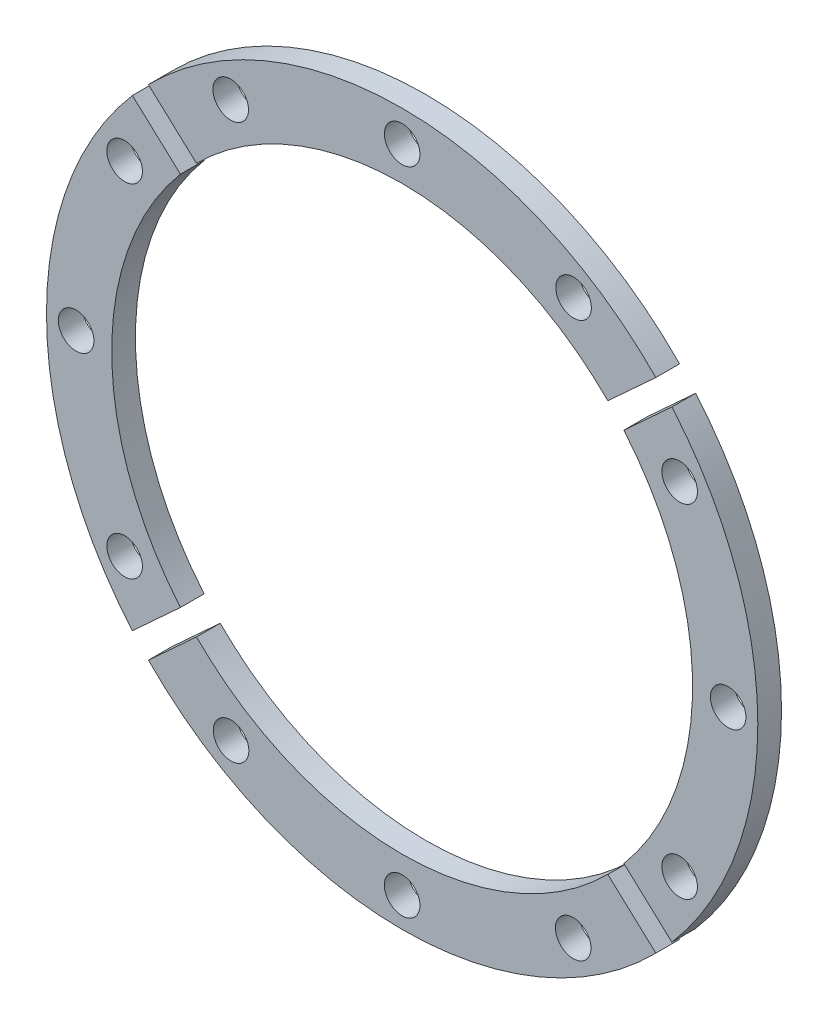
from build123d import *

# Parameters (mm, degrees)
IZIM1_R                       = 15
Y_KSEKLIK_EKSTR_ZYON1_DEPTH   = 20
Y_KSEKLIK_EKSTR_ZYON1_2_DEPTH = 20
Y_KSEKLIK_EKSTR_ZYON1_3_DEPTH = 20
Y_KSEKLIK_EKSTR_ZYON1_4_DEPTH = 20


with BuildPart() as part:
    # Çizim1 → Yükseklik-Ekstrüzyon1 (new body)
    with BuildSketch(Plane.XY):
        with BuildLine():
            Line((-187.021124904, 158.265911805), (-227.547884488, 195.504374031))
            ThreePointArc((-227.547884488, 195.504374031), (-300, 0), (-227.547884488, -195.504374031))
            Line((-227.547884488, -195.504374031), (-187.021124904, -158.265911805))
            ThreePointArc((-187.021124904, -158.265911805), (-245, 0), (-187.021124904, 158.265911805))
        make_face()
        with Locations((-234.090909091, -144.313707876)):
            Circle(IZIM1_R, mode=Mode.SUBTRACT)
        with Locations((-275, 0)):
            Circle(IZIM1_R, mode=Mode.SUBTRACT)
        with Locations((-234.090909091, 144.313707876)):
            Circle(IZIM1_R, mode=Mode.SUBTRACT)
    extrude(amount=Y_KSEKLIK_EKSTR_ZYON1_DEPTH)


with BuildPart() as body_2:
    # Çizim1 → Y_kseklik-Ekstr_zyon1 2 (new body)
    with BuildSketch(Plane.XY):
        with BuildLine():
            ThreePointArc((214.015840502, 210.23134879), (0, 300), (-214.015840502, 210.23134879))
            Line((-214.015840502, 210.23134879), (-173.489080919, 172.992886565))
            ThreePointArc((-173.489080919, 172.992886565), (0, 245), (173.489080919, 172.992886565))
            Line((173.489080919, 172.992886565), (214.015840502, 210.23134879))
        make_face()
        with Locations((-144.598899786, 233.914852416)):
            Circle(IZIM1_R, mode=Mode.SUBTRACT)
        with Locations((0, 273.804176558)):
            Circle(IZIM1_R, mode=Mode.SUBTRACT)
        with Locations((144.598899786, 233.914852416)):
            Circle(IZIM1_R, mode=Mode.SUBTRACT)
    extrude(amount=Y_KSEKLIK_EKSTR_ZYON1_2_DEPTH)


with BuildPart() as body_3:
    # Çizim1 → Y_kseklik-Ekstr_zyon1 3 (new body)
    with BuildSketch(Plane.XY):
        with BuildLine():
            ThreePointArc((227.547884488, -195.504374031), (300, 0), (227.547884488, 195.504374031))
            Line((227.547884488, 195.504374031), (187.021124904, 158.265911805))
            ThreePointArc((187.021124904, 158.265911805), (245, 0), (187.021124904, -158.265911805))
            Line((187.021124904, -158.265911805), (227.547884488, -195.504374031))
        make_face()
        with Locations((234.090909091, -144.313707876)):
            Circle(IZIM1_R, mode=Mode.SUBTRACT)
        with Locations((275, 0)):
            Circle(IZIM1_R, mode=Mode.SUBTRACT)
        with Locations((234.090909091, 144.313707876)):
            Circle(IZIM1_R, mode=Mode.SUBTRACT)
    extrude(amount=Y_KSEKLIK_EKSTR_ZYON1_3_DEPTH)


with BuildPart() as body_4:
    # Çizim1 → Y_kseklik-Ekstr_zyon1 4 (new body)
    with BuildSketch(Plane.XY):
        with BuildLine():
            ThreePointArc((-214.015840502, -210.23134879), (0, -300), (214.015840502, -210.23134879))
            Line((214.015840502, -210.23134879), (173.489080919, -172.992886565))
            ThreePointArc((173.489080919, -172.992886565), (0, -245), (-173.489080919, -172.992886565))
            Line((-173.489080919, -172.992886565), (-214.015840502, -210.23134879))
        make_face()
        with Locations((-144.313707876, -234.090909091)):
            Circle(IZIM1_R, mode=Mode.SUBTRACT)
        with Locations((0, -275)):
            Circle(IZIM1_R, mode=Mode.SUBTRACT)
        with Locations((144.313707876, -234.090909091)):
            Circle(IZIM1_R, mode=Mode.SUBTRACT)
    extrude(amount=Y_KSEKLIK_EKSTR_ZYON1_4_DEPTH)


solid = Compound([part.part, body_2.part, body_3.part, body_4.part])
